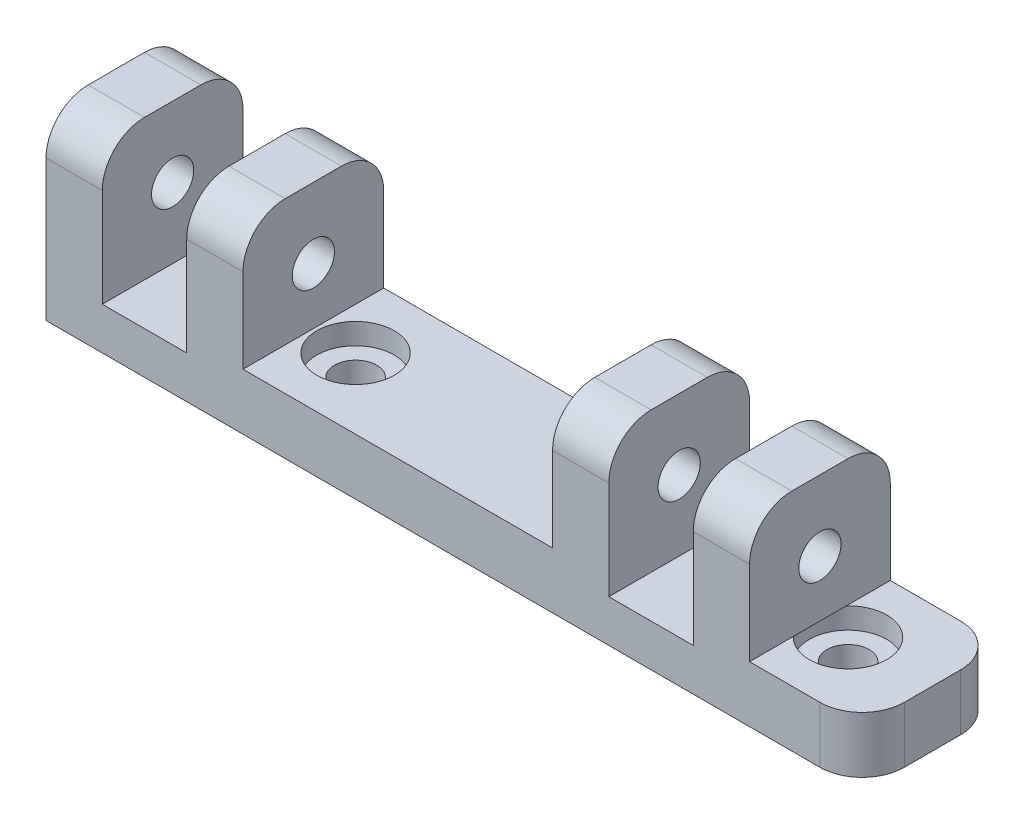
from build123d import *

# Parameters (mm, degrees)
EXTRUDE_1_DEPTH     = 10
SKETCH_2_W          = 10
SKETCH_2_H          = 4
EXTRUDE_2_DEPTH     = 8
SKETCH_3_R          = 1.5
CUT_EXTRUDE_1_DEPTH = 5
SKETCH_4_R          = 2.75
CUT_EXTRUDE_2_DEPTH = 1.5
FILLET_1_R          = 3
SKETCH_5_R          = 1.5
CUT_EXTRUDE_3_DEPTH = 53.621288468
FILLET_2_R          = 3


with BuildPart() as part:
    # 草图1 → 凸台-拉伸1 (new body)
    with BuildSketch(Plane.XY):
        Polygon((0, 0), (0, 13), (4, 13), (4, 3), (10, 3), (10, 13), (14, 13), (14, 4), (36, 4), (36, 13), (40, 13), (40, 3), (46, 3), (46, 13), (50, 13), (50, 0), align=None)
    extrude(amount=EXTRUDE_1_DEPTH)

    # 草图2 → 凸台-拉伸2 (add)
    with BuildSketch(Plane(origin=(50, 0, 0), x_dir=(0, 0, -1), z_dir=(1, 0, 0))):
        with Locations((-5, 2)):
            Rectangle(SKETCH_2_W, SKETCH_2_H)
    extrude(amount=EXTRUDE_2_DEPTH)

    # 草图3 → 切除-拉伸1 (cut)
    with BuildSketch(Plane(origin=(0, 4, 0), x_dir=(1, 0, 0), z_dir=(0, 1, 0))):
        with Locations(Location((17, -5, 0), (0, 0, 270))):
            Circle(SKETCH_3_R)
        with Locations(Location((52, -5, 0), (0, 0, 270))):
            Circle(SKETCH_3_R)
    extrude(amount=-CUT_EXTRUDE_1_DEPTH, mode=Mode.SUBTRACT)

    # 草图4 → 切除-拉伸2 (cut)
    with BuildSketch(Plane(origin=(0, 4, 0), x_dir=(1, 0, 0), z_dir=(0, 1, 0))):
        with Locations(Location((17, -5, 0), (0, 0, 270))):
            Circle(SKETCH_4_R)
        with Locations(Location((52, -5, 0), (0, 0, 270))):
            Circle(SKETCH_4_R)
    extrude(amount=-CUT_EXTRUDE_2_DEPTH, mode=Mode.SUBTRACT)

    # 圆角1
    fillet_1_edges = [part.edges().sort_by_distance(p)[0] for p in [
        (48, 13, 10),
        (2, 13, 0),
        (12, 13, 0),
        (38, 13, 0),
        (48, 13, 0),
        (38, 13, 10),
        (12, 13, 10),
        (2, 13, 10),
    ]]
    fillet(fillet_1_edges, radius=FILLET_1_R)

    # 草图5 → 切除-拉伸3 (cut, through all)
    with BuildSketch(Plane(origin=(50, 0, 0), x_dir=(0, 0, -1), z_dir=(1, 0, 0))):
        with Locations((-5, 8)):
            Circle(SKETCH_5_R)
    extrude(amount=-CUT_EXTRUDE_3_DEPTH, mode=Mode.SUBTRACT)

    # 圆角2
    fillet_2_edges = [part.edges().sort_by_distance(p)[0] for p in [
        (58, 2, 10),
        (58, 2, 0),
    ]]
    fillet(fillet_2_edges, radius=FILLET_2_R)


solid = part.part
